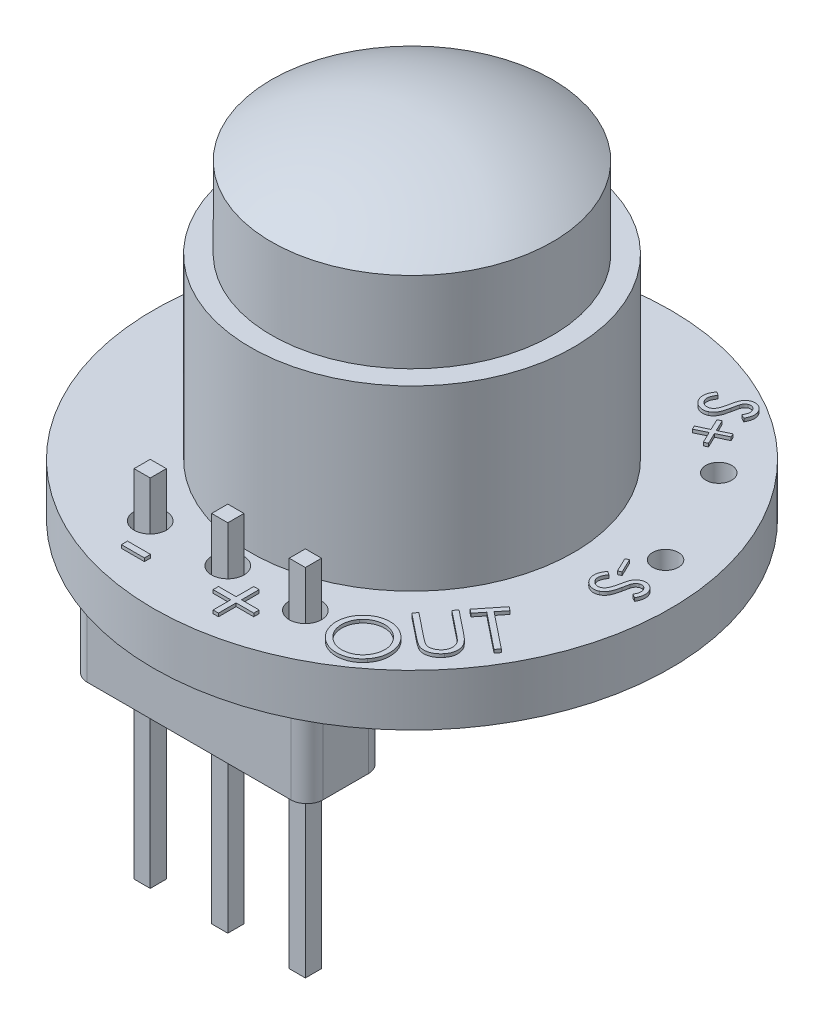
from build123d import *

# Parameters (mm, degrees)
SKETCH2_R             = 0.5
SKETCH2_R_2           = 0.4
CUT_EXTRUDE1_DEPTH    = 10
SKETCH3_W             = 0.5
SKETCH3_H             = 0.5
BOSS_EXTRUDE1_DEPTH   = 11
BOSS_EXTRUDE1_2_DEPTH = 11
BOSS_EXTRUDE1_3_DEPTH = 11
SKETCH4_W             = 7.3
SKETCH4_H             = 2.4
SKETCH4_W_2           = 0.6
SKETCH4_H_2           = 0.58
BOSS_EXTRUDE2_DEPTH   = 2.5
FILLET1_R             = 0.5
SKETCH5_W             = 0.712339744
SKETCH5_H             = 0.189957265
BOSS_EXTRUDE3_DEPTH   = 0.1
BOSS_EXTRUDE4_DEPTH   = 0.1
BOSS_EXTRUDE5_DEPTH   = 0.1
BOSS_EXTRUDE6_DEPTH   = 0.1


with BuildPart() as part:
    # Sketch1 → Revolve1 (revolve)
    with BuildSketch(Plane.XY, mode=Mode.PRIVATE) as revolve1_sk:
        with BuildLine():
            Line((0, 0), (-8, 0))
            Line((-8, 0), (-8, 1.6))
            Line((-8, 1.6), (-5, 1.6))
            Line((-5, 1.6), (-5, 7.1))
            Line((-5, 7.1), (-4.35, 7.1))
            Line((-4.35, 7.1), (-4.35, 9.6))
            ThreePointArc((-4.35, 9.6), (-2.268058239, 10.557782717), (0, 10.886022044))
            Line((0, 10.886022044), (0, 0))
        make_face()
    revolve(revolve1_sk.sketch.rotate(Axis((0, 0, 0), (0, 1, 0)), 270), axis=Axis((0, 0, 0), (0, 1, 0)))

    # Sketch2 → Cut-Extrude1 (cut)
    with BuildSketch(Plane(origin=(0, 1.6, 0), x_dir=(1, 0, 0), z_dir=(0, 1, 0))):
        with Locations(Location((0, -5.7, 0), (0, 0, 270))):
            Circle(SKETCH2_R)
        with Locations(Location((-2.4, -5.7, 0), (0, 0, 270))):
            Circle(SKETCH2_R)
        with Locations(Location((2.4, -5.7, 0), (0, 0, 270))):
            Circle(SKETCH2_R)
        with Locations(Location((5.107916726, 4.384254409, 0), (0, 0, 270))):
            Circle(SKETCH2_R_2)
        with Locations(Location((6.618665368, 1.227097691, 0), (0, 0, 270))):
            Circle(SKETCH2_R_2)
    extrude(amount=-CUT_EXTRUDE1_DEPTH, mode=Mode.SUBTRACT)

    # Sketch4 → Boss-Extrude2 (add)
    with BuildSketch(Plane.XZ):
        with Locations((0, 5.7)):
            Rectangle(SKETCH4_W, SKETCH4_H)
        with Locations((-2.4, 5.7)):
            Rectangle(SKETCH4_W_2, SKETCH4_H_2, mode=Mode.SUBTRACT)
        with Locations((2.4, 5.7)):
            Rectangle(SKETCH4_W_2, SKETCH4_H_2, mode=Mode.SUBTRACT)
        with Locations((0, 5.7)):
            Rectangle(SKETCH4_W_2, SKETCH4_H_2, mode=Mode.SUBTRACT)
    extrude(amount=BOSS_EXTRUDE2_DEPTH)

    # Fillet1
    fillet1_edges = [part.edges().sort_by_distance(p)[0] for p in [
        (-3.65, -1.25, 6.9),
        (-3.65, -1.25, 4.5),
        (3.65, -1.25, 4.5),
        (3.65, -1.25, 6.9),
    ]]
    fillet(fillet1_edges, radius=FILLET1_R)

    # Sketch5 → Boss-Extrude3 (add)
    with BuildSketch(Plane(origin=(0, 1.6, 0), x_dir=(1, 0, 0), z_dir=(0, 1, 0))):
        with Locations((-1.753838912, -6.787660257)):
            Rectangle(SKETCH5_W, SKETCH5_H)
        Polygon((1.060377968, -6.502724359), (1.060377968, -5.956597222), (1.226590575, -5.956597222), (1.226590575, -6.502724359), (1.772717712, -6.502724359), (1.772717712, -6.668936966), (1.226590575, -6.668936966), (1.226590575, -7.215064103), (1.060377968, -7.215064103), (1.060377968, -6.668936966), (0.514250831, -6.668936966), (0.514250831, -6.502724359), align=None)
    extrude(amount=BOSS_EXTRUDE3_DEPTH)

    # Sketch6 → Boss-Extrude4 (add)
    # profile 1 of 3: a face of its own
    with BuildSketch(Plane(origin=(0, 1.6, 0), x_dir=(1, 0, 0), z_dir=(0, 1, 0))):
        with BuildLine():
            add(Edge.make_bspline(
                [(3.45565374, -5.112927996), (3.474456808, -5.090635309), (3.511395438, -5.046841323), (3.572620469, -4.988039111), (3.637259679, -4.936560232), (3.705661392, -4.892738259), (3.777661719, -4.85647774), (3.853347213, -4.82826854), (3.932460888, -4.807135641), (4.01414629, -4.793619283), (4.096672819, -4.787910699), (4.178060798, -4.79000474), (4.257539746, -4.800283525), (4.335096332, -4.818329817), (4.410519648, -4.844955561), (4.483737132, -4.879768566), (4.555374312, -4.921860157), (4.60006583, -4.955786845), (4.622746088, -4.973004117)],
                knots=[0, 0, 0, 0, 1.066511499, 2.095162004, 3.100088383, 4.08562894, 5.062191344, 6.044099933, 7.035727419, 8.054037545, 9.068758869, 10.058176567, 11.028045822, 11.996129672, 12.966440888, 13.948464376, 14.958877201, 16, 16, 16, 16], degree=3))
            add(Edge.make_bspline(
                [(4.622746088, -4.973004117), (4.644444112, -4.991127776), (4.687105535, -5.026761485), (4.743636254, -5.086943249), (4.793032513, -5.150689007), (4.835802465, -5.217975564), (4.870465638, -5.2894798), (4.898393897, -5.364607135), (4.918654101, -5.443715779), (4.931387239, -5.525610757), (4.937435028, -5.6081977), (4.934690977, -5.689778549), (4.924756301, -5.769200833), (4.906320271, -5.846521852), (4.880349338, -5.921755339), (4.84573738, -5.99456073), (4.804317101, -6.065821421), (4.770585547, -6.110012363), (4.753447711, -6.132464254)],
                knots=[0, 0, 0, 0, 1.043661746, 2.051988523, 3.042879516, 4.019624495, 4.991647831, 5.972966726, 6.975971515, 8.002864854, 9.031295247, 10.030385878, 11.013508103, 11.983320138, 12.96171231, 13.948011582, 14.957455602, 16, 16, 16, 16], degree=3))
            add(Edge.make_bspline(
                [(4.753447711, -6.132464254), (4.735096632, -6.154359688), (4.698961967, -6.197473457), (4.638361795, -6.254830429), (4.574276049, -6.305005107), (4.506420815, -6.348079433), (4.434671134, -6.38328382), (4.359315129, -6.411613388), (4.280205902, -6.432161115), (4.198430146, -6.445330676), (4.116029655, -6.451173271), (4.034781262, -6.44888785), (3.955674105, -6.439240002), (3.87889817, -6.421177939), (3.804323844, -6.395720091), (3.732118175, -6.361889509), (3.66182018, -6.320731798), (3.618053467, -6.287581261), (3.595895627, -6.270798088)],
                knots=[0, 0, 0, 0, 1.055679664, 2.078713208, 3.078420863, 4.061468785, 5.044876103, 6.028463069, 7.033374715, 8.061830367, 9.087293923, 10.083267793, 11.062910567, 12.028900188, 12.994515975, 13.97130026, 14.972927109, 16, 16, 16, 16], degree=3))
            add(Edge.make_bspline(
                [(3.595895627, -6.270798088), (3.581521303, -6.258906029), (3.552932839, -6.235254433), (3.513298821, -6.196573075), (3.476318381, -6.156146443), (3.442079116, -6.113833505), (3.411303499, -6.069141274), (3.38323486, -6.022640348), (3.358030188, -5.974115142), (3.335807771, -5.923811251), (3.317264458, -5.872201853), (3.301792801, -5.820103193), (3.290087071, -5.76760585), (3.281694164, -5.714832595), (3.277311409, -5.661790928), (3.276373333, -5.608468922), (3.278818225, -5.554799797), (3.285294371, -5.501062788), (3.295059409, -5.447951143), (3.30818791, -5.395925042), (3.324294983, -5.345155483), (3.344296579, -5.295953852), (3.366553362, -5.247589964), (3.393407454, -5.201355519), (3.422335735, -5.155809866), (3.444499974, -5.127283428), (3.45565374, -5.112927996)],
                knots=[0, 0, 0, 0, 1.034884061, 2.058235615, 3.070008709, 4.074109269, 5.075984681, 6.078740394, 7.086401269, 8.108314806, 9.128008134, 10.127532292, 11.122215522, 12.110582353, 13.090511065, 14.073014041, 15.068236315, 16.069282503, 17.074192551, 18.06287441, 19.045095604, 20.027087791, 21.008604176, 21.996498276, 22.9917727, 24, 24, 24, 24], degree=3))
        make_face()
        with BuildLine():
            add(Edge.make_bspline(
                [(3.580313196, -5.20292449), (3.571563713, -5.214362402), (3.554146736, -5.237131047), (3.531007871, -5.273241676), (3.510152992, -5.310562155), (3.492173813, -5.349323864), (3.476408463, -5.38931117), (3.463377177, -5.430762617), (3.452987791, -5.473593583), (3.444962138, -5.517429803), (3.439964475, -5.561631193), (3.437680622, -5.605708767), (3.438322626, -5.649370761), (3.441794474, -5.69261363), (3.448207569, -5.735422335), (3.457397367, -5.77772001), (3.469601037, -5.819547352), (3.484432825, -5.860823609), (3.502288129, -5.900984908), (3.522320312, -5.94010247), (3.545228087, -5.977588896), (3.570872514, -6.013505196), (3.59842768, -6.048447829), (3.629229211, -6.081409671), (3.662147208, -6.113400311), (3.685962851, -6.133047621), (3.697976457, -6.142958545)],
                knots=[0, 0, 0, 0, 0.983964773, 1.958709364, 2.928486245, 3.904172917, 4.876976642, 5.864642596, 6.871601289, 7.88777202, 8.908761868, 9.909942935, 10.902698617, 11.891320892, 12.872988738, 13.859298318, 14.847601921, 15.849202396, 16.854882941, 17.849751659, 18.851325926, 19.854497622, 20.864995358, 21.890500158, 22.935880144, 24, 24, 24, 24], degree=3))
            add(Edge.make_bspline(
                [(3.697976457, -6.142958545), (3.716283938, -6.156773544), (3.752248298, -6.183912591), (3.809689679, -6.218065989), (3.868683996, -6.246099888), (3.929710506, -6.266875), (3.992020693, -6.282202936), (4.056125831, -6.290329292), (4.121840882, -6.292220318), (4.188458073, -6.287627036), (4.254343346, -6.277523839), (4.317687468, -6.260643952), (4.378191453, -6.238934768), (4.435236196, -6.210623513), (4.489377413, -6.177160821), (4.540087789, -6.13771724), (4.587894981, -6.092815384), (4.616291583, -6.058990213), (4.630696309, -6.041831742)],
                knots=[0, 0, 0, 0, 1.053355528, 2.069277367, 3.065193028, 4.049640408, 5.026792572, 6.009297442, 7.013258688, 8.04341214, 9.074175897, 10.071448894, 11.051607986, 12.023292483, 12.992543806, 13.97183087, 14.971172038, 16, 16, 16, 16], degree=3))
            add(Edge.make_bspline(
                [(4.630696309, -6.041831742), (4.639848978, -6.029851193), (4.658016816, -6.006070081), (4.682607078, -5.968765002), (4.704170443, -5.930188975), (4.723293306, -5.890689611), (4.739989534, -5.850198764), (4.75363709, -5.808515731), (4.764368605, -5.76576633), (4.772734651, -5.722354425), (4.777923139, -5.678462205), (4.781186686, -5.634826259), (4.780133407, -5.591480414), (4.777337048, -5.548616587), (4.770538744, -5.506111975), (4.762153808, -5.463838472), (4.749159752, -5.422327942), (4.734577834, -5.381055204), (4.7166449, -5.340921292), (4.696736326, -5.301839579), (4.673631851, -5.264577008), (4.648085888, -5.228712613), (4.620633891, -5.193774587), (4.589724658, -5.16122446), (4.55702962, -5.129338524), (4.533319846, -5.109795874), (4.521301276, -5.099889634)],
                knots=[0, 0, 0, 0, 1.026213425, 2.037009955, 3.03867123, 4.032791005, 5.023157936, 6.018167913, 7.015843731, 8.022173571, 9.025601079, 10.023616149, 10.997972454, 11.974891032, 12.945498563, 13.9263542, 14.90582835, 15.903425862, 16.905087137, 17.895979796, 18.887397904, 19.886560358, 20.893019572, 21.909134835, 22.94013297, 24, 24, 24, 24], degree=3))
            add(Edge.make_bspline(
                [(4.521301276, -5.099889634), (4.509132136, -5.090488853), (4.485021719, -5.071863318), (4.446952635, -5.047300207), (4.408588, -5.024683629), (4.368936561, -5.005819394), (4.328814825, -4.989044676), (4.287669545, -4.97537943), (4.24569335, -4.96457646), (4.203084555, -4.956635925), (4.160164685, -4.951552377), (4.117137211, -4.949301418), (4.074117495, -4.949986004), (4.03115512, -4.953323774), (3.988422287, -4.960305746), (3.945629842, -4.96932083), (3.90299522, -4.981917128), (3.860627238, -4.997086976), (3.819240668, -5.014673869), (3.779594495, -5.034907221), (3.741717108, -5.057101155), (3.705568288, -5.08171753), (3.671392703, -5.108644606), (3.638983984, -5.137847696), (3.608491979, -5.169198317), (3.589714985, -5.191671827), (3.580313196, -5.20292449)],
                knots=[0, 0, 0, 0, 1.050757827, 2.081840579, 3.094837263, 4.093081857, 5.08085562, 6.066234131, 7.054007893, 8.041808237, 9.026946903, 10.006552914, 10.984952035, 11.966485985, 12.949383271, 13.942908505, 14.954244963, 15.985709621, 17.018115709, 18.026019314, 19.02649715, 20.017402582, 21.013356202, 21.99852152, 22.997843949, 24, 24, 24, 24], degree=3))
        make_face(mode=Mode.SUBTRACT)
    # profile 2 of 3: a face of its own
    with BuildSketch(Plane(origin=(0, 1.6, 0), x_dir=(1, 0, 0), z_dir=(0, 1, 0))):
        with BuildLine():
            Line((4.215687219, -4.222996498), (4.313633934, -4.100245096))
            Line((4.313633934, -4.100245096), (5.05491248, -4.692059499))
            add(Edge.make_bspline(
                [(5.05491248, -4.692059499), (5.065398817, -4.700443536), (5.085259815, -4.716322802), (5.113688107, -4.738803877), (5.139393887, -4.75831531), (5.161850705, -4.775543355), (5.181370231, -4.789946542), (5.197898594, -4.801727257), (5.211510204, -4.811063477), (5.219834501, -4.816111952), (5.223457151, -4.818308998)],
                knots=[0, 0, 0, 0, 1.529341844, 2.896555115, 4.128230771, 5.205315812, 6.120604565, 6.891210804, 7.517466163, 8, 8, 8, 8], degree=3))
            add(Edge.make_bspline(
                [(5.223457151, -4.818308998), (5.236552542, -4.825825302), (5.261901739, -4.840374869), (5.301381496, -4.856530478), (5.339987574, -4.868094123), (5.378663913, -4.873663886), (5.418018232, -4.873327007), (5.458510206, -4.866637413), (5.500650037, -4.854434027), (5.543086137, -4.835907515), (5.584731334, -4.813344396), (5.622985982, -4.786417296), (5.657632079, -4.756587107), (5.677108974, -4.733668917), (5.686795993, -4.722270336)],
                knots=[0, 0, 0, 0, 1.043125178, 2.019213249, 2.942567521, 3.823755495, 4.710778409, 5.65322756, 6.653111229, 7.736937606, 8.849100576, 9.922865017, 10.966917051, 12, 12, 12, 12], degree=3))
            add(Edge.make_bspline(
                [(5.686795993, -4.722270336), (5.694573016, -4.711944075), (5.710038529, -4.691409108), (5.728742771, -4.657671671), (5.743839982, -4.622191303), (5.754801467, -4.585027195), (5.76223755, -4.547134016), (5.76512518, -4.509030212), (5.763562284, -4.471235866), (5.757367998, -4.433821775), (5.747155845, -4.396825038), (5.732714583, -4.360185778), (5.713653336, -4.324272946), (5.6979506, -4.301607061), (5.689976082, -4.290096358)],
                knots=[0, 0, 0, 0, 0.997261099, 1.983169351, 2.969892853, 3.969569931, 4.969749605, 5.94664521, 6.913439779, 7.883728152, 8.868752455, 9.8720092, 10.919315556, 12, 12, 12, 12], degree=3))
            add(Edge.make_bspline(
                [(5.689976082, -4.290096358), (5.68642804, -4.285596664), (5.678511792, -4.27555713), (5.66400848, -4.260099991), (5.646271907, -4.242419037), (5.625230849, -4.222619933), (5.60060281, -4.201158582), (5.573027585, -4.177177526), (5.541715915, -4.151478624), (5.519645116, -4.133722158), (5.50807504, -4.124413766)],
                knots=[0, 0, 0, 0, 0.557701609, 1.244321178, 2.061681397, 2.996263366, 4.056489344, 5.241981574, 6.554176416, 8, 8, 8, 8], degree=3))
            Line((5.50807504, -4.124413766), (4.766796494, -3.532599362))
            Line((4.766796494, -3.532599362), (4.865061218, -3.40984796))
            Line((4.865061218, -3.40984796), (5.606339764, -4.001662363))
            add(Edge.make_bspline(
                [(5.606339764, -4.001662363), (5.619672422, -4.012376485), (5.645715734, -4.033304885), (5.682486634, -4.065609116), (5.716899786, -4.096819396), (5.748124312, -4.127867513), (5.776751361, -4.158092838), (5.80305789, -4.18745384), (5.825840606, -4.216927906), (5.846559467, -4.245666655), (5.864642288, -4.274873725), (5.880051365, -4.30526745), (5.892628252, -4.337177562), (5.903271268, -4.370276906), (5.911078411, -4.404781029), (5.916936275, -4.440555336), (5.920004143, -4.477764729), (5.920688808, -4.516015793), (5.918523484, -4.554620982), (5.913211497, -4.592971438), (5.904108094, -4.630570846), (5.892185395, -4.6677564), (5.875953195, -4.70389107), (5.85714435, -4.739803001), (5.835025507, -4.775170698), (5.817697904, -4.797464125), (5.808911378, -4.808768733)],
                knots=[0, 0, 0, 0, 1.299983518, 2.539319159, 3.719842426, 4.830894536, 5.88534066, 6.884393406, 7.825727116, 8.71557918, 9.576543404, 10.434183136, 11.30202001, 12.181191921, 13.074430304, 13.988469102, 14.934652864, 15.909763273, 16.894414977, 17.870989117, 18.848194645, 19.831757771, 20.834799286, 21.854817962, 22.912215483, 24, 24, 24, 24], degree=3))
            add(Edge.make_bspline(
                [(5.808911378, -4.808768733), (5.799015813, -4.820796798), (5.779542685, -4.844466396), (5.747769883, -4.876767416), (5.715538476, -4.906627364), (5.681527243, -4.932759735), (5.646518065, -4.955932211), (5.610612901, -4.976611765), (5.573164728, -4.993249991), (5.535135439, -5.007471428), (5.496422655, -5.017760493), (5.457850162, -5.025161745), (5.419673605, -5.029403816), (5.381667487, -5.030054704), (5.343998592, -5.027150924), (5.306579229, -5.021013217), (5.269441156, -5.011977297), (5.245429898, -5.003099259), (5.233315425, -4.998619995)],
                knots=[0, 0, 0, 0, 1.148121159, 2.259346517, 3.338428395, 4.386101709, 5.418171225, 6.433404605, 7.437530958, 8.436715205, 9.424735718, 10.387600952, 11.331200203, 12.253807945, 13.186757595, 14.113397242, 15.048146597, 16, 16, 16, 16], degree=3))
            add(Edge.make_bspline(
                [(5.233315425, -4.998619995), (5.225317413, -4.995224309), (5.207976908, -4.987862115), (5.181093057, -4.97365704), (5.151045852, -4.956077106), (5.118261519, -4.934656176), (5.081970473, -4.910182301), (5.043233326, -4.881334922), (5.000712785, -4.849748828), (4.971947199, -4.826775607), (4.956965765, -4.814810901)],
                knots=[0, 0, 0, 0, 0.626278209, 1.357835047, 2.19024504, 3.135814201, 4.180953577, 5.345862278, 6.617695802, 8, 8, 8, 8], degree=3))
            Line((4.956965765, -4.814810901), (4.215687219, -4.222996498))
        make_face()
    # profile 3 of 3: a face of its own
    with BuildSketch(Plane(origin=(0, 1.6, 0), x_dir=(1, 0, 0), z_dir=(0, 1, 0))):
        Polygon((5.135109249, -3.314252852), (5.015855944, -3.219168217), (5.553926857, -2.545625549), (5.673180162, -2.640710184), (5.454390098, -2.914515773), (6.562968824, -3.799852312), (6.463114057, -3.925147784), (5.354535331, -3.039811246), align=None)
    extrude(amount=BOSS_EXTRUDE4_DEPTH)

    # Sketch7 → Boss-Extrude5 (add)
    # profile 1 of 5: a face of its own
    with BuildSketch(Plane(origin=(0, 1.6, 0), x_dir=(1, 0, 0), z_dir=(0, 1, 0))):
        with BuildLine():
            Line((-2.684158384, 7.248012811), (-2.708327054, 7.093460528))
            add(Edge.make_bspline(
                [(-2.708327054, 7.093460528), (-2.731695746, 7.097700972), (-2.7764203, 7.105816614), (-2.841578449, 7.110776205), (-2.901309211, 7.110462423), (-2.955784726, 7.102707769), (-3.005054946, 7.089333091), (-3.049169293, 7.069488568), (-3.087831506, 7.042935964), (-3.108760296, 7.020415749), (-3.119194442, 7.009188192)],
                knots=[0, 0, 0, 0, 1.293405282, 2.475404832, 3.555726147, 4.541728328, 5.465316488, 6.328686665, 7.166759007, 8, 8, 8, 8], degree=3))
            add(Edge.make_bspline(
                [(-3.119194442, 7.009188192), (-3.127202789, 6.998880041), (-3.143141295, 6.978364381), (-3.16216512, 6.944396036), (-3.176936643, 6.908388924), (-3.187286109, 6.870921625), (-3.193236636, 6.833016336), (-3.193433242, 6.79577337), (-3.189086054, 6.759679645), (-3.179506296, 6.725123992), (-3.165413709, 6.692584278), (-3.147611196, 6.662630443), (-3.126177996, 6.635447846), (-3.109245855, 6.620042851), (-3.10074993, 6.612313192)],
                knots=[0, 0, 0, 0, 1.062818521, 2.115260257, 3.161440792, 4.228465735, 5.276927396, 6.279264429, 7.254533303, 8.231370227, 9.191206659, 10.136622781, 11.065025959, 12, 12, 12, 12], degree=3))
            add(Edge.make_bspline(
                [(-3.10074993, 6.612313192), (-3.090174095, 6.604411193), (-3.068750317, 6.588403884), (-3.031536287, 6.570999406), (-2.990382403, 6.559164734), (-2.961430293, 6.555623719), (-2.946515656, 6.55379957)],
                knots=[0, 0, 0, 0, 0.944074053, 1.912438393, 2.924595624, 4, 4, 4, 4], degree=3))
            add(Edge.make_bspline(
                [(-2.946515656, 6.55379957), (-2.935177366, 6.553142705), (-2.911454196, 6.551768341), (-2.873966821, 6.552228102), (-2.833133527, 6.554919655), (-2.788677716, 6.559384036), (-2.740839247, 6.566084213), (-2.689563688, 6.575170433), (-2.634844842, 6.585943083), (-2.59732416, 6.594314624), (-2.57794344, 6.598638813)],
                knots=[0, 0, 0, 0, 0.731427744, 1.530370624, 2.412916412, 3.366855266, 4.407855327, 5.523716838, 6.720914716, 8, 8, 8, 8], degree=3))
            add(Edge.make_bspline(
                [(-2.57794344, 6.598638813), (-2.558662931, 6.603039291), (-2.521849649, 6.611441353), (-2.468957489, 6.622619076), (-2.421040281, 6.63188226), (-2.378102193, 6.639186262), (-2.340177663, 6.64492097), (-2.307150258, 6.647837309), (-2.279137201, 6.650026917), (-2.262162115, 6.649238675), (-2.254528476, 6.648884206)],
                knots=[0, 0, 0, 0, 1.44652743, 2.761930328, 3.954127154, 5.015951821, 5.948003039, 6.758101147, 7.441522298, 8, 8, 8, 8], degree=3))
            add(Edge.make_bspline(
                [(-2.254528476, 6.648884206), (-2.243058704, 6.648127429), (-2.220436038, 6.646634783), (-2.187300224, 6.641014413), (-2.155260654, 6.633448516), (-2.124460043, 6.623356558), (-2.095064639, 6.610499281), (-2.066977614, 6.595379718), (-2.039755686, 6.578476586), (-2.023099142, 6.56500467), (-2.01474983, 6.558251694)],
                knots=[0, 0, 0, 0, 1.05636292, 2.083541417, 3.08595596, 4.081570525, 5.059419876, 6.031861724, 7.013444726, 8, 8, 8, 8], degree=3))
            add(Edge.make_bspline(
                [(-2.01474983, 6.558251694), (-2.002243435, 6.547010168), (-1.977508202, 6.524776603), (-1.946275371, 6.486297871), (-1.920880259, 6.444541861), (-1.901497476, 6.399903284), (-1.888089261, 6.353306462), (-1.881294062, 6.305245339), (-1.881389917, 6.256233107), (-1.888147703, 6.206758398), (-1.901134808, 6.158058435), (-1.920011598, 6.111216978), (-1.944936667, 6.066746089), (-1.96594041, 6.039855694), (-1.976588772, 6.026222948)],
                knots=[0, 0, 0, 0, 1.016602265, 2.010642858, 2.986650846, 3.966447372, 4.94733564, 5.912763226, 6.894406604, 7.904325903, 8.926802839, 9.937129659, 10.954177243, 12, 12, 12, 12], degree=3))
            add(Edge.make_bspline(
                [(-1.976588772, 6.026222948), (-1.988823891, 6.012476619), (-2.013109639, 5.985191236), (-2.05610551, 5.951300238), (-2.102629824, 5.922558352), (-2.144848186, 5.903686624), (-2.181284178, 5.891757941), (-2.211319576, 5.884645486), (-2.243644939, 5.878461769), (-2.278513639, 5.874514929), (-2.315758947, 5.871948313), (-2.355543795, 5.87120786), (-2.39776997, 5.871270579), (-2.426682108, 5.873006157), (-2.441517659, 5.873896726)],
                knots=[0, 0, 0, 0, 1.296186183, 2.572827748, 3.845256252, 5.147577217, 5.823996161, 6.547753535, 7.323725672, 8.144705779, 9.021783, 9.956917682, 10.951642668, 12, 12, 12, 12], degree=3))
            Line((-2.441517659, 5.873896726), (-2.433885447, 6.035445203))
            add(Edge.make_bspline(
                [(-2.433885447, 6.035445203), (-2.421908454, 6.034997627), (-2.398913251, 6.034138303), (-2.365619738, 6.033271993), (-2.334754691, 6.034007917), (-2.306317099, 6.035476172), (-2.280328749, 6.0380672), (-2.256797467, 6.041324033), (-2.235832385, 6.046227129), (-2.211105109, 6.053258007), (-2.183096412, 6.065478544), (-2.152365638, 6.084176976), (-2.123869169, 6.106378831), (-2.107779083, 6.124331132), (-2.099658184, 6.133391918)],
                knots=[0, 0, 0, 0, 1.188125187, 2.281138537, 3.300611859, 4.247772235, 5.103045265, 5.889166431, 6.600366815, 7.235458859, 8.435834274, 9.614395521, 10.795950895, 12, 12, 12, 12], degree=3))
            add(Edge.make_bspline(
                [(-2.099658184, 6.133391918), (-2.090391082, 6.145489027), (-2.072483308, 6.168865515), (-2.053914769, 6.208181662), (-2.044175064, 6.248920727), (-2.043118554, 6.290081647), (-2.049160436, 6.330153839), (-2.063468758, 6.367364844), (-2.085148402, 6.401224846), (-2.104828111, 6.419465671), (-2.114922607, 6.428822106)],
                knots=[0, 0, 0, 0, 1.104768761, 2.134858295, 3.13236084, 4.126319214, 5.108844294, 6.057118042, 7.003419512, 8, 8, 8, 8], degree=3))
            add(Edge.make_bspline(
                [(-2.114922607, 6.428822106), (-2.121598424, 6.434062442), (-2.134971927, 6.444560281), (-2.156987549, 6.45755754), (-2.180545297, 6.468026844), (-2.205639892, 6.476907496), (-2.233490043, 6.483006225), (-2.264628679, 6.485873408), (-2.299417745, 6.486687284), (-2.323757638, 6.48461229), (-2.33657475, 6.483519622)],
                knots=[0, 0, 0, 0, 0.866286222, 1.735410298, 2.60291388, 3.496714424, 4.450428772, 5.506367805, 6.686881455, 8, 8, 8, 8], degree=3))
            add(Edge.make_bspline(
                [(-2.33657475, 6.483519622), (-2.341030318, 6.482906505), (-2.351666844, 6.481442846), (-2.370232389, 6.478186673), (-2.393936819, 6.473308066), (-2.422918171, 6.467353438), (-2.457030585, 6.459613849), (-2.496327411, 6.450367593), (-2.540947881, 6.43984404), (-2.572431155, 6.432425607), (-2.589073748, 6.428504097)],
                knots=[0, 0, 0, 0, 0.41754574, 0.996783341, 1.749524629, 2.664427385, 3.743648285, 4.996942581, 6.412532805, 8, 8, 8, 8], degree=3))
            add(Edge.make_bspline(
                [(-2.589073748, 6.428504097), (-2.609079777, 6.423713996), (-2.647909344, 6.414416919), (-2.704765971, 6.402983084), (-2.758240159, 6.394117251), (-2.808267348, 6.38720009), (-2.855076593, 6.38313209), (-2.898580045, 6.381029243), (-2.938737375, 6.381562097), (-2.975722004, 6.384702066), (-3.010168504, 6.390359833), (-3.042918927, 6.39721753), (-3.074270542, 6.405975586), (-3.103768026, 6.417467371), (-3.132336156, 6.429535679), (-3.159025386, 6.444347877), (-3.184243304, 6.460810837), (-3.19984741, 6.473219701), (-3.207600892, 6.479385508)],
                knots=[0, 0, 0, 0, 1.531459641, 2.972399831, 4.316530809, 5.566597053, 6.731237031, 7.813466526, 8.807973759, 9.718969414, 10.573996258, 11.405199452, 12.209556122, 12.993760493, 13.760618039, 14.51643167, 15.262833799, 16, 16, 16, 16], degree=3))
            add(Edge.make_bspline(
                [(-3.207600892, 6.479385508), (-3.218202966, 6.48870569), (-3.239134425, 6.507106335), (-3.266619688, 6.538383075), (-3.290470559, 6.571737399), (-3.310739107, 6.607287761), (-3.326913097, 6.645113274), (-3.339777668, 6.685004136), (-3.348504556, 6.727237614), (-3.35397265, 6.771049523), (-3.355211901, 6.815455163), (-3.352377686, 6.859216007), (-3.345463046, 6.901892184), (-3.333776566, 6.943217377), (-3.318653161, 6.98365995), (-3.298586834, 7.02240305), (-3.275102454, 7.060441136), (-3.256299979, 7.083997461), (-3.246715976, 7.096004598)],
                knots=[0, 0, 0, 0, 0.98653909, 1.947703887, 2.904425789, 3.850748232, 4.80387207, 5.776973729, 6.777456744, 7.815743692, 8.861600909, 9.879569258, 10.87909023, 11.879243505, 12.87895696, 13.89362574, 14.926338309, 16, 16, 16, 16], degree=3))
            add(Edge.make_bspline(
                [(-3.246715976, 7.096004598), (-3.238895402, 7.105029235), (-3.22351165, 7.122781483), (-3.198344751, 7.147152637), (-3.17202948, 7.169408143), (-3.144286667, 7.189505286), (-3.115263161, 7.207354919), (-3.084898567, 7.223073645), (-3.053148273, 7.236290445), (-3.020045706, 7.247613049), (-2.985298747, 7.256530181), (-2.948506086, 7.262902599), (-2.909597635, 7.266512762), (-2.868502525, 7.268301394), (-2.825299357, 7.266680356), (-2.77994872, 7.263372723), (-2.732658045, 7.256818539), (-2.700568225, 7.250992226), (-2.684158384, 7.248012811)],
                knots=[0, 0, 0, 0, 0.93085302, 1.831068974, 2.728586307, 3.616497699, 4.499741019, 5.3833324, 6.279897581, 7.179126247, 8.109391839, 9.074270311, 10.087609769, 11.154746453, 12.279431786, 13.456744589, 14.699449998, 16, 16, 16, 16], degree=3))
        make_face()
    # profile 2 of 5: a face of its own
    with BuildSketch(Plane(origin=(0, 1.6, 0), x_dir=(1, 0, 0), z_dir=(0, 1, 0))):
        with BuildLine():
            Line((-2.511427124, 5.447126922), (-2.713680729, 5.205440223))
            add(Edge.make_bspline(
                [(-2.713680729, 5.205440223), (-2.727187699, 5.189275318), (-2.753029158, 5.15834871), (-2.791105756, 5.114765342), (-2.825831543, 5.075309737), (-2.858012489, 5.040579537), (-2.887249144, 5.01044064), (-2.913292397, 4.98440878), (-2.936676305, 4.963113836), (-2.95171557, 4.950870735), (-2.958547516, 4.945309013)],
                knots=[0, 0, 0, 0, 1.413129804, 2.703592196, 3.882354506, 4.939095828, 5.87953774, 6.699191181, 7.409076409, 8, 8, 8, 8], degree=3))
            add(Edge.make_bspline(
                [(-2.958547516, 4.945309013), (-2.968205079, 4.938384595), (-2.987291434, 4.924699785), (-3.017233935, 4.906846929), (-3.047927425, 4.891902099), (-3.079201598, 4.879301517), (-3.111367878, 4.869778152), (-3.144270295, 4.863171913), (-3.177747874, 4.858924891), (-3.211689752, 4.857722687), (-3.245748098, 4.859227016), (-3.279422226, 4.863937499), (-3.312447958, 4.872119573), (-3.344980157, 4.882838335), (-3.376904822, 4.896936674), (-3.408191293, 4.914322411), (-3.439024533, 4.934502574), (-3.458474608, 4.950124987), (-3.468315645, 4.958029365)],
                knots=[0, 0, 0, 0, 1.029795294, 2.035196582, 3.01736098, 3.986544661, 4.954682366, 5.920593611, 6.892778204, 7.876660425, 8.860928743, 9.844639316, 10.818559335, 11.806509414, 12.810397934, 13.838552119, 14.906385216, 16, 16, 16, 16], degree=3))
            add(Edge.make_bspline(
                [(-3.468315645, 4.958029365), (-3.483881317, 4.971937002), (-3.514355413, 4.999165036), (-3.55234739, 5.046095507), (-3.582713571, 5.0961078), (-3.604800367, 5.149286251), (-3.618638966, 5.204704616), (-3.623332349, 5.261800115), (-3.619468552, 5.320015543), (-3.608591255, 5.368868706), (-3.595784302, 5.408825202), (-3.582349383, 5.439925808), (-3.56699397, 5.472533125), (-3.547856756, 5.505767422), (-3.526737729, 5.540612734), (-3.502070599, 5.576096087), (-3.474668451, 5.612767366), (-3.454937526, 5.637149999), (-3.444782993, 5.649698536)],
                knots=[0, 0, 0, 0, 1.271861019, 2.490018831, 3.66793922, 4.830580208, 5.989762342, 7.13859645, 8.311766746, 9.535884537, 10.182172239, 10.86921045, 11.601056785, 12.379996679, 13.207470857, 14.086490997, 15.015211369, 16, 16, 16, 16], degree=3))
            Line((-3.444782993, 5.649698536), (-4.373686739, 5.684997515))
            Line((-4.373686739, 5.684997515), (-4.248073257, 5.835097675))
            Line((-4.248073257, 5.835097675), (-3.319805529, 5.799162679))
            Line((-3.319805529, 5.799162679), (-3.261927925, 5.8684886))
            Line((-3.261927925, 5.8684886), (-3.826075561, 6.340095672))
            Line((-3.826075561, 6.340095672), (-3.724630749, 6.46125703))
            Line((-3.724630749, 6.46125703), (-2.511427124, 5.447126922))
        make_face()
        with BuildLine():
            Line((-2.731489223, 5.425184313), (-3.143946655, 5.769905868))
            Line((-3.143946655, 5.769905868), (-3.320123538, 5.562246112))
            add(Edge.make_bspline(
                [(-3.320123538, 5.562246112), (-3.328235723, 5.552432501), (-3.343954215, 5.533417258), (-3.365773, 5.505192154), (-3.385498893, 5.478465136), (-3.402101886, 5.452584037), (-3.417186429, 5.428616747), (-3.42985477, 5.405901877), (-3.43957534, 5.384316317), (-3.449844987, 5.357941016), (-3.45772186, 5.325595305), (-3.461399845, 5.286897292), (-3.458821427, 5.248451546), (-3.450145373, 5.210822487), (-3.43590235, 5.174856471), (-3.416050631, 5.141662369), (-3.392370021, 5.110469652), (-3.372704289, 5.093088498), (-3.362736719, 5.084278865)],
                knots=[0, 0, 0, 0, 1.116236397, 2.162863901, 3.127685928, 4.027324493, 4.85781702, 5.610680761, 6.305240904, 6.931804578, 8.090415848, 9.210360426, 10.328104755, 11.453128123, 12.583551359, 13.704112773, 14.836330242, 16, 16, 16, 16], degree=3))
            add(Edge.make_bspline(
                [(-3.362736719, 5.084278865), (-3.352459166, 5.076322911), (-3.33211647, 5.060575432), (-3.298022476, 5.042787558), (-3.262035805, 5.030171356), (-3.224492232, 5.023326082), (-3.186674453, 5.021563774), (-3.14957663, 5.025808875), (-3.113953721, 5.035385921), (-3.085406873, 5.048119112), (-3.062490579, 5.061571302), (-3.044408112, 5.075071109), (-3.024648411, 5.090823791), (-3.003958386, 5.109415673), (-2.982113698, 5.131069612), (-2.959234909, 5.155371134), (-2.934746194, 5.182229013), (-2.918619479, 5.201456293), (-2.910210176, 5.21148239)],
                knots=[0, 0, 0, 0, 1.1609165, 2.297839924, 3.422554902, 4.560901358, 5.699919185, 6.797477887, 7.887925391, 8.987571682, 9.5828509, 10.261971053, 11.003997309, 11.84354918, 12.748871641, 13.755115475, 14.829401153, 16, 16, 16, 16], degree=3))
            Line((-2.910210176, 5.21148239), (-2.731489223, 5.425184313))
        make_face(mode=Mode.SUBTRACT)
    # profile 3 of 5: a face of its own
    with BuildSketch(Plane(origin=(0, 1.6, 0), x_dir=(1, 0, 0), z_dir=(0, 1, 0))):
        with BuildLine():
            Line((-3.73067945, 3.92527566), (-3.879507575, 3.8798004))
            Line((-3.879507575, 3.8798004), (-4.102113745, 4.62235098))
            add(Edge.make_bspline(
                [(-4.102113745, 4.62235098), (-4.107716419, 4.608676298), (-4.118625408, 4.582050266), (-4.138376705, 4.544853742), (-4.158966808, 4.51035524), (-4.175238904, 4.48989883), (-4.183205993, 4.479883032)],
                knots=[0, 0, 0, 0, 1.076665876, 2.096380751, 3.067956394, 4, 4, 4, 4], degree=3))
            add(Edge.make_bspline(
                [(-4.183205993, 4.479883032), (-4.19335781, 4.468309994), (-4.213369865, 4.445496318), (-4.247188417, 4.415606156), (-4.282668421, 4.389308313), (-4.320674297, 4.367633923), (-4.360481231, 4.349533618), (-4.402754598, 4.336423623), (-4.446884361, 4.326682091), (-4.492589713, 4.321545052), (-4.5387977, 4.319991173), (-4.584369926, 4.323694622), (-4.628915729, 4.331252234), (-4.672315954, 4.343351661), (-4.714470462, 4.360164124), (-4.755766393, 4.38076585), (-4.795623424, 4.406436198), (-4.82075845, 4.426246629), (-4.833534017, 4.436315824)],
                knots=[0, 0, 0, 0, 1.016609958, 2.004020865, 2.976579252, 3.930793524, 4.890471119, 5.861008393, 6.850480366, 7.873372514, 8.896696496, 9.901577207, 10.889882598, 11.879255341, 12.873281186, 13.885366133, 14.925179325, 16, 16, 16, 16], degree=3))
            add(Edge.make_bspline(
                [(-4.833534017, 4.436315824), (-4.850188915, 4.451148953), (-4.88283958, 4.480228179), (-4.923798844, 4.530728476), (-4.95751589, 4.584709997), (-4.983436975, 4.642464674), (-5.000826005, 4.703082296), (-5.010377848, 4.76553417), (-5.010296322, 4.829510562), (-5.002570209, 4.89411157), (-4.98588909, 4.95758714), (-4.962119778, 5.018572255), (-4.930007417, 5.075824198), (-4.903304215, 5.110484673), (-4.889821578, 5.127984995)],
                knots=[0, 0, 0, 0, 1.036330215, 2.031646901, 3.01300658, 3.99108843, 4.966717147, 5.939111266, 6.920669249, 7.934404377, 8.958454525, 9.965978925, 10.973008195, 12, 12, 12, 12], degree=3))
            add(Edge.make_bspline(
                [(-4.889821578, 5.127984995), (-4.875601636, 5.143877816), (-4.847397297, 5.175400203), (-4.798180918, 5.215053579), (-4.744915167, 5.248368323), (-4.68737397, 5.273896858), (-4.627157679, 5.292168559), (-4.56507738, 5.3017893), (-4.502022096, 5.30281301), (-4.438768114, 5.294589117), (-4.376888405, 5.278738485), (-4.317420158, 5.255961225), (-4.26185194, 5.224749671), (-4.228175412, 5.198899863), (-4.211190768, 5.185862599)],
                knots=[0, 0, 0, 0, 1.01108554, 2.005423111, 2.988630093, 3.986629124, 4.98497073, 5.967971594, 6.959554196, 7.968959879, 8.986985962, 9.986088421, 10.984290474, 12, 12, 12, 12], degree=3))
            add(Edge.make_bspline(
                [(-4.211190768, 5.185862599), (-4.198862041, 5.174981337), (-4.17385639, 5.152911496), (-4.140170836, 5.114394566), (-4.108386513, 5.071761674), (-4.078224019, 5.023844695), (-4.050069933, 4.968757644), (-4.022720264, 4.905152956), (-3.996605142, 4.831958941), (-3.980721403, 4.779626687), (-3.972366149, 4.752098577)],
                knots=[0, 0, 0, 0, 0.784521981, 1.591201043, 2.437545377, 3.322327837, 4.291299357, 5.38864803, 6.626361792, 8, 8, 8, 8], degree=3))
            Line((-3.972366149, 4.752098577), (-3.73067945, 3.92527566))
        make_face()
        with BuildLine():
            add(Edge.make_bspline(
                [(-4.265570275, 4.597864302), (-4.258485324, 4.606734505), (-4.244620549, 4.624092899), (-4.227356409, 4.652255697), (-4.212946638, 4.68115234), (-4.201763064, 4.711215291), (-4.19376999, 4.742228518), (-4.189006963, 4.774199225), (-4.187423293, 4.807118705), (-4.189148577, 4.840518862), (-4.193355213, 4.873791066), (-4.201186186, 4.905858066), (-4.211186382, 4.936678509), (-4.224731095, 4.9658658), (-4.241352666, 4.99342425), (-4.260494056, 5.019802009), (-4.282839395, 5.044381858), (-4.29966034, 5.059134287), (-4.308183457, 5.066609294)],
                knots=[0, 0, 0, 0, 1.039622142, 2.034470746, 3.020790762, 3.995316586, 4.968533898, 5.950970277, 6.952862731, 7.983868882, 9.013042296, 10.021648694, 11.004805423, 11.978556044, 12.963295687, 13.950476658, 14.961513436, 16, 16, 16, 16], degree=3))
            add(Edge.make_bspline(
                [(-4.308183457, 5.066609294), (-4.317090292, 5.073532054), (-4.334613233, 5.087151606), (-4.362378215, 5.104961727), (-4.391575494, 5.118815735), (-4.421518418, 5.130129417), (-4.452551863, 5.138082678), (-4.484517777, 5.142859058), (-4.517435913, 5.144429234), (-4.550846697, 5.142745459), (-4.583951484, 5.138403698), (-4.616079228, 5.13115995), (-4.646530237, 5.12049285), (-4.675799287, 5.107573432), (-4.703198835, 5.091160589), (-4.729198219, 5.071899743), (-4.753660307, 5.049688881), (-4.768487285, 5.033039515), (-4.775974422, 5.02463213)],
                knots=[0, 0, 0, 0, 1.036721582, 2.039603334, 3.024479077, 4.001807027, 4.977822702, 5.963083953, 6.967857222, 8.001827902, 9.033960574, 10.033760977, 11.022869041, 11.995376661, 12.969591164, 13.951764117, 14.965708004, 16, 16, 16, 16], degree=3))
            add(Edge.make_bspline(
                [(-4.775974422, 5.02463213), (-4.782897234, 5.015725298), (-4.796516888, 4.998202362), (-4.81432627, 4.97043734), (-4.828183009, 4.941240208), (-4.8394866, 4.911296743), (-4.847477541, 4.880265317), (-4.852111908, 4.848286153), (-4.854231403, 4.815391727), (-4.852400335, 4.781967171), (-4.848066415, 4.748761941), (-4.840846525, 4.716535196), (-4.830369006, 4.685930894), (-4.816625041, 4.657076457), (-4.801026034, 4.629245824), (-4.781638447, 4.603337046), (-4.759272353, 4.579145315), (-4.742708784, 4.564342452), (-4.734315267, 4.556841165)],
                knots=[0, 0, 0, 0, 1.036622074, 2.039407565, 3.024188777, 4.001422919, 4.977344914, 5.962511596, 6.967707917, 8.001579353, 9.033612957, 10.042814529, 11.031827655, 11.999447104, 12.977069693, 13.959148374, 14.965807279, 16, 16, 16, 16], degree=3))
            add(Edge.make_bspline(
                [(-4.734315267, 4.556841165), (-4.725447716, 4.549751197), (-4.707909974, 4.535729058), (-4.679481588, 4.518449274), (-4.650403325, 4.503860101), (-4.620272156, 4.492829241), (-4.589272786, 4.484228676), (-4.557108541, 4.479811482), (-4.524121896, 4.47760601), (-4.490704264, 4.479501901), (-4.457434628, 4.483661733), (-4.425369177, 4.491508566), (-4.394540308, 4.50149152), (-4.365516873, 4.515027718), (-4.338026578, 4.531315343), (-4.312043559, 4.550502943), (-4.287880316, 4.572917167), (-4.273073543, 4.589474132), (-4.265570275, 4.597864302)],
                knots=[0, 0, 0, 0, 1.039702551, 2.056265058, 3.04266136, 4.017262557, 4.993025493, 5.985147827, 6.987635865, 8.018721759, 9.047974773, 10.05665918, 11.03989195, 12.013717885, 12.985214322, 13.964647005, 14.968593687, 16, 16, 16, 16], degree=3))
        make_face(mode=Mode.SUBTRACT)
    # profile 4 of 5: a face of its own
    with BuildSketch(Plane(origin=(0, 1.6, 0), x_dir=(1, 0, 0), z_dir=(0, 1, 0))):
        with BuildLine():
            add(Edge.make_bspline(
                [(-4.678004737, 4.086574602), (-4.658732772, 4.07013697), (-4.621248094, 4.038165174), (-4.568121287, 3.990016588), (-4.520040346, 3.942740699), (-4.476332554, 3.897207607), (-4.437692068, 3.852442821), (-4.403656066, 3.809158636), (-4.374443153, 3.76689166), (-4.349767568, 3.725784775), (-4.329368566, 3.685215798), (-4.311696667, 3.645507456), (-4.297346218, 3.605981209), (-4.286104601, 3.566782151), (-4.278210076, 3.527845797), (-4.272973743, 3.489289956), (-4.27105166, 3.450992892), (-4.272367733, 3.413136635), (-4.276536094, 3.376057785), (-4.283126998, 3.339864791), (-4.292754432, 3.30492131), (-4.304820676, 3.270936129), (-4.319914482, 3.238167562), (-4.337427592, 3.206207768), (-4.357711961, 3.175331631), (-4.373196026, 3.155964299), (-4.380984504, 3.146222539)],
                knots=[0, 0, 0, 0, 1.643993172, 3.197626918, 4.652320135, 6.019795141, 7.292907061, 8.48889341, 9.591961112, 10.625576922, 11.597885558, 12.537463435, 13.445034137, 14.324877497, 15.181688949, 16.021424951, 16.848065683, 17.667257366, 18.477180199, 19.267940345, 20.052389936, 20.827124605, 21.606063693, 22.3912672, 23.190808052, 24, 24, 24, 24], degree=3))
            add(Edge.make_bspline(
                [(-4.380984504, 3.146222539), (-4.389310784, 3.136643179), (-4.405806338, 3.117665093), (-4.433003714, 3.092010821), (-4.461503205, 3.06851584), (-4.4915575, 3.047592501), (-4.523420614, 3.029289553), (-4.55678203, 3.013566001), (-4.591482616, 2.999607001), (-4.62785547, 2.989021353), (-4.665303186, 2.980543862), (-4.704055804, 2.975615469), (-4.743806808, 2.973270669), (-4.784721967, 2.974433816), (-4.826713952, 2.978130439), (-4.869787461, 2.985374875), (-4.914010731, 2.995132895), (-4.959344056, 3.008342654), (-5.006060278, 3.024745554), (-5.053703254, 3.046158882), (-5.103216792, 3.070892659), (-5.153957192, 3.100278324), (-5.206177763, 3.133831337), (-5.259876021, 3.171355837), (-5.314981379, 3.213117233), (-5.351540476, 3.243091074), (-5.370309925, 3.25847965)],
                knots=[0, 0, 0, 0, 0.817339333, 1.619266385, 2.405449416, 3.195509303, 3.975736317, 4.770035953, 5.570332597, 6.382834967, 7.20809755, 8.041711811, 8.896789644, 9.771259707, 10.676527122, 11.610729599, 12.58341213, 13.592878258, 14.651405961, 15.770679898, 16.955804169, 18.216364247, 19.546376426, 20.954152364, 22.436261117, 24, 24, 24, 24], degree=3))
            add(Edge.make_bspline(
                [(-5.370309925, 3.25847965), (-5.38876965, 3.27413613), (-5.424736769, 3.304641376), (-5.475211347, 3.351452718), (-5.52151856, 3.397319493), (-5.563600568, 3.442366417), (-5.601213832, 3.486996396), (-5.63463937, 3.530762211), (-5.663825967, 3.573757485), (-5.688424098, 3.616247572), (-5.709083686, 3.658258149), (-5.727152262, 3.699491909), (-5.741392859, 3.740588342), (-5.752591286, 3.781182734), (-5.760920128, 3.821207294), (-5.766222634, 3.860851343), (-5.767584319, 3.900109551), (-5.766545963, 3.938827456), (-5.761859892, 3.976736276), (-5.755023599, 4.013781032), (-5.745055813, 4.049670807), (-5.732741687, 4.084529383), (-5.717337564, 4.117948284), (-5.69943927, 4.150302737), (-5.678747775, 4.181529499), (-5.663128305, 4.20127124), (-5.655245823, 4.211234057)],
                knots=[0, 0, 0, 0, 1.56105138, 3.04156856, 4.438769213, 5.764324799, 7.016171793, 8.201757153, 9.314885985, 10.365625086, 11.365482604, 12.333267515, 13.267379546, 14.168064964, 15.047692009, 15.902523688, 16.744184248, 17.578761358, 18.397990109, 19.205233916, 20.006374262, 20.797887425, 21.587241979, 22.376833381, 23.180856846, 24, 24, 24, 24], degree=3))
            add(Edge.make_bspline(
                [(-5.655245823, 4.211234057), (-5.647026569, 4.220707866), (-5.630843273, 4.239361315), (-5.604074834, 4.264604125), (-5.576024347, 4.287554393), (-5.546553831, 4.308404676), (-5.515138469, 4.326044984), (-5.482645408, 4.341853252), (-5.448562187, 4.354819629), (-5.413158512, 4.365295594), (-5.376538921, 4.373430869), (-5.338734168, 4.378017936), (-5.299944479, 4.37993887), (-5.260284378, 4.379029858), (-5.219577036, 4.374790624), (-5.177966478, 4.367373438), (-5.135302297, 4.357113557), (-5.091333381, 4.344082722), (-5.046076122, 4.327084197), (-4.998976614, 4.305935949), (-4.950226494, 4.279987951), (-4.899232788, 4.250066177), (-4.846440968, 4.215608038), (-4.791876809, 4.176664367), (-4.735005455, 4.133795528), (-4.697385719, 4.102630329), (-4.678004737, 4.086574602)],
                knots=[0, 0, 0, 0, 0.814714867, 1.604132403, 2.387453959, 3.169137844, 3.94674298, 4.726329278, 5.515746814, 6.313537194, 7.124310223, 7.950622935, 8.785251134, 9.646660243, 10.526171825, 11.442473167, 12.391596195, 13.376788617, 14.420987592, 15.531104122, 16.729860213, 18.008301406, 19.372658964, 20.825433452, 22.364522828, 24, 24, 24, 24], degree=3))
        make_face()
        with BuildLine():
            add(Edge.make_bspline(
                [(-4.775951452, 3.973999482), (-4.792625508, 3.987766431), (-4.824915048, 4.014426319), (-4.873105096, 4.051694025), (-4.918915268, 4.085358624), (-4.962751499, 4.115124539), (-5.004268578, 4.141223724), (-5.043759575, 4.163697461), (-5.081172286, 4.182093651), (-5.116599932, 4.197109585), (-5.150633755, 4.208430789), (-5.183548298, 4.217980959), (-5.215913019, 4.224472839), (-5.247636051, 4.229147036), (-5.278701196, 4.231062897), (-5.309101682, 4.230345231), (-5.338803328, 4.227619805), (-5.376730374, 4.220394834), (-5.421320609, 4.206723857), (-5.470508014, 4.183966864), (-5.513588545, 4.153428612), (-5.537236339, 4.12813087), (-5.549030879, 4.115513404)],
                knots=[0, 0, 0, 0, 1.476897284, 2.860031931, 4.160550152, 5.359484534, 6.478510468, 7.509534219, 8.461562622, 9.324871558, 10.135436324, 10.910219661, 11.664256053, 12.388212392, 13.09912472, 13.787138846, 14.463665093, 15.133963118, 16.421170599, 17.638978116, 18.822420147, 20, 20, 20, 20], degree=3))
            add(Edge.make_bspline(
                [(-5.549030879, 4.115513404), (-5.559539563, 4.101650806), (-5.580473843, 4.074035216), (-5.602293845, 4.026199826), (-5.616727157, 3.974614601), (-5.622213845, 3.928894085), (-5.622324277, 3.890938888), (-5.619551906, 3.861727372), (-5.615040489, 3.832182324), (-5.60708986, 3.802387143), (-5.596978001, 3.772181463), (-5.584147055, 3.741775082), (-5.569190107, 3.710852793), (-5.557342198, 3.69078464), (-5.55125694, 3.680477347)],
                knots=[0, 0, 0, 0, 1.341527718, 2.672448319, 4.034671374, 5.471108039, 6.216935681, 6.965639853, 7.737710062, 8.524901334, 9.346497693, 10.198872141, 11.074914664, 12, 12, 12, 12], degree=3))
            add(Edge.make_bspline(
                [(-5.55125694, 3.680477347), (-5.543329347, 3.667568672), (-5.527197669, 3.641301107), (-5.500135526, 3.602767482), (-5.469604152, 3.564754032), (-5.437067072, 3.526159126), (-5.401236944, 3.488018457), (-5.36271886, 3.449851522), (-5.321381141, 3.411628392), (-5.292275299, 3.38685317), (-5.277451351, 3.374234859)],
                knots=[0, 0, 0, 0, 0.880784319, 1.792287695, 2.735725792, 3.715225478, 4.727048705, 5.777508399, 6.868058892, 8, 8, 8, 8], degree=3))
            add(Edge.make_bspline(
                [(-5.277451351, 3.374234859), (-5.262482559, 3.361834792), (-5.233243132, 3.337613011), (-5.189011484, 3.303872466), (-5.145575271, 3.273348719), (-5.10351322, 3.245331689), (-5.062419638, 3.22036833), (-5.022246061, 3.198717545), (-4.983111237, 3.179878892), (-4.944923522, 3.163867143), (-4.907692729, 3.150917923), (-4.871775871, 3.140235469), (-4.836903068, 3.132553096), (-4.803206636, 3.127554962), (-4.770722465, 3.124439454), (-4.739307164, 3.124389043), (-4.709118989, 3.127375975), (-4.670901483, 3.133989659), (-4.626321413, 3.147745798), (-4.57777691, 3.171103683), (-4.534629597, 3.200690478), (-4.511466796, 3.225885172), (-4.499919801, 3.238445095)],
                knots=[0, 0, 0, 0, 1.32836003, 2.594764112, 3.800774032, 4.956129809, 6.048246113, 7.085521028, 8.073824068, 9.015627562, 9.913787911, 10.766627247, 11.575208516, 12.351839573, 13.093664055, 13.803638996, 14.494961617, 15.164336767, 16.45225405, 17.667325484, 18.83712772, 20, 20, 20, 20], degree=3))
            add(Edge.make_bspline(
                [(-4.499919801, 3.238445095), (-4.489398549, 3.252302382), (-4.468381012, 3.279984073), (-4.446694896, 3.328098241), (-4.43208915, 3.380055765), (-4.42705052, 3.42625814), (-4.427050774, 3.46458823), (-4.429259531, 3.494162482), (-4.434030931, 3.523948097), (-4.441439419, 3.554022747), (-4.451363642, 3.584299639), (-4.463814198, 3.61489354), (-4.478890027, 3.645692117), (-4.496202093, 3.67722376), (-4.516653442, 3.709776286), (-4.54181446, 3.742949619), (-4.570427683, 3.778170264), (-4.603575373, 3.814444479), (-4.640583289, 3.852532345), (-4.68203164, 3.891668245), (-4.72708902, 3.93296763), (-4.759308002, 3.960023273), (-4.775951452, 3.973999482)],
                knots=[0, 0, 0, 0, 1.185688259, 2.368562968, 3.57951734, 4.862635763, 5.529067666, 6.197425848, 6.886960375, 7.587966549, 8.311841808, 9.062443309, 9.843232223, 10.653764132, 11.519908749, 12.467411033, 13.49695201, 14.620118704, 15.823923869, 17.125314889, 18.515015867, 20, 20, 20, 20], degree=3))
        make_face(mode=Mode.SUBTRACT)
    # profile 5 of 5: a face of its own
    with BuildSketch(Plane(origin=(0, 1.6, 0), x_dir=(1, 0, 0), z_dir=(0, 1, 0))):
        with BuildLine():
            Line((-5.352160452, 2.817469899), (-5.254849755, 2.933861125))
            add(Edge.make_bspline(
                [(-5.254849755, 2.933861125), (-5.240850858, 2.920831901), (-5.213379446, 2.895263375), (-5.176575097, 2.853772711), (-5.145126869, 2.81020457), (-5.117600568, 2.765439641), (-5.096132173, 2.718166961), (-5.078696018, 2.669529006), (-5.066729478, 2.618955592), (-5.059350585, 2.567326745), (-5.057255025, 2.515460417), (-5.059624148, 2.464325002), (-5.067321492, 2.414446605), (-5.080026956, 2.365919755), (-5.098116603, 2.318776432), (-5.121027097, 2.272927947), (-5.149157935, 2.228460507), (-5.171165702, 2.200660442), (-5.182343746, 2.186540412)],
                knots=[0, 0, 0, 0, 1.097131231, 2.153008532, 3.176348939, 4.177922017, 5.163234319, 6.15027287, 7.138866212, 8.140291478, 9.138885633, 10.113453524, 11.073636989, 12.02980358, 12.986763292, 13.96617981, 14.966995122, 16, 16, 16, 16], degree=3))
            add(Edge.make_bspline(
                [(-5.182343746, 2.186540412), (-5.193970426, 2.17316286), (-5.216774741, 2.146924422), (-5.254587256, 2.112197358), (-5.2939358, 2.082184539), (-5.33513034, 2.057161141), (-5.377811728, 2.0364846), (-5.422663469, 2.021439107), (-5.468921769, 2.01031029), (-5.516527665, 2.004925984), (-5.564102923, 2.003536384), (-5.610736206, 2.006760423), (-5.65577756, 2.014062536), (-5.699407556, 2.025501582), (-5.741497535, 2.041620023), (-5.782342471, 2.061544188), (-5.821429727, 2.086282366), (-5.845770186, 2.105540989), (-5.858112475, 2.115306437)],
                knots=[0, 0, 0, 0, 1.11994052, 2.196626809, 3.239550621, 4.244211424, 5.239528014, 6.231498992, 7.229722543, 8.242311368, 9.254744903, 10.235603561, 11.193147592, 12.136083321, 13.082158214, 14.03836422, 15.005315501, 16, 16, 16, 16], degree=3))
            add(Edge.make_bspline(
                [(-5.858112475, 2.115306437), (-5.874532707, 2.130057646), (-5.907107925, 2.159321778), (-5.948520804, 2.210280242), (-5.983591455, 2.265722519), (-6.007063186, 2.316434593), (-6.022960848, 2.361023637), (-6.034217219, 2.399313728), (-6.045489094, 2.441999675), (-6.055626831, 2.48942413), (-6.066389342, 2.541281493), (-6.075962331, 2.597866749), (-6.085665283, 2.65889253), (-6.091209448, 2.701169778), (-6.094075016, 2.723021281)],
                knots=[0, 0, 0, 0, 1.186268586, 2.353374675, 3.519727801, 4.708941261, 5.351258533, 6.06589384, 6.855891121, 7.726403033, 8.67504069, 9.705660083, 10.814142908, 12, 12, 12, 12], degree=3))
            Line((-6.094075016, 2.723021281), (-6.167535052, 3.297345199))
            Line((-6.167535052, 3.297345199), (-6.635644026, 2.737331678))
            Line((-6.635644026, 2.737331678), (-6.75267127, 2.835278392))
            Line((-6.75267127, 2.835278392), (-6.063864178, 3.65923923))
            Line((-6.063864178, 3.65923923), (-5.950971049, 2.777082779))
            add(Edge.make_bspline(
                [(-5.950971049, 2.777082779), (-5.94829803, 2.755658884), (-5.943158269, 2.714464374), (-5.934433192, 2.6553437), (-5.926075656, 2.601325604), (-5.917050049, 2.552485424), (-5.908205273, 2.508688544), (-5.899557699, 2.469884198), (-5.890182188, 2.436323848), (-5.878418906, 2.398576321), (-5.859783705, 2.356963091), (-5.833252242, 2.311299174), (-5.800451714, 2.270432557), (-5.774897283, 2.246969671), (-5.762073814, 2.23519576)],
                knots=[0, 0, 0, 0, 1.321102773, 2.540256064, 3.656799769, 4.665732225, 5.579123136, 6.391063275, 7.097656391, 7.711009086, 8.80893229, 9.879123281, 10.935722801, 12, 12, 12, 12], degree=3))
            add(Edge.make_bspline(
                [(-5.762073814, 2.23519576), (-5.753503997, 2.228455225), (-5.736512832, 2.215090932), (-5.709176832, 2.198217851), (-5.680508366, 2.184793345), (-5.651022787, 2.174293895), (-5.620344618, 2.166787283), (-5.588558581, 2.162896683), (-5.555659452, 2.161385933), (-5.522149177, 2.163912246), (-5.488668707, 2.168718012), (-5.456222327, 2.177098228), (-5.425037533, 2.188195546), (-5.395580036, 2.202670626), (-5.367110758, 2.219540366), (-5.340557423, 2.240048875), (-5.315206698, 2.263348625), (-5.299856766, 2.280738634), (-5.292056786, 2.289575267)],
                knots=[0, 0, 0, 0, 0.994007563, 1.970794382, 2.922369547, 3.87654485, 4.821662567, 5.796724968, 6.793409586, 7.820583704, 8.857135706, 9.874937394, 10.872044047, 11.871024259, 12.864326134, 13.885429403, 14.925493167, 16, 16, 16, 16], degree=3))
            add(Edge.make_bspline(
                [(-5.292056786, 2.289575267), (-5.28433685, 2.299294189), (-5.269203339, 2.318346343), (-5.2501155, 2.348914222), (-5.233992815, 2.379946212), (-5.22193677, 2.412148897), (-5.212915599, 2.444909153), (-5.207487294, 2.478599349), (-5.205601706, 2.51302416), (-5.207266592, 2.548060344), (-5.212194567, 2.583276076), (-5.221339313, 2.618153633), (-5.233755448, 2.652704038), (-5.250033664, 2.68680566), (-5.270332428, 2.720251573), (-5.293964205, 2.75346716), (-5.321279995, 2.786229636), (-5.34172153, 2.806909347), (-5.352160452, 2.817469899)],
                knots=[0, 0, 0, 0, 1.006434913, 1.972930028, 2.919272708, 3.83945293, 4.757580478, 5.672519303, 6.602934726, 7.550097986, 8.514754053, 9.482779038, 10.470476726, 11.490058661, 12.543335957, 13.641257156, 14.795455728, 16, 16, 16, 16], degree=3))
        make_face()
    extrude(amount=BOSS_EXTRUDE5_DEPTH)

    # Sketch8 → Boss-Extrude6 (add)
    with BuildSketch(Plane(origin=(0, 1.6, 0), x_dir=(1, 0, 0), z_dir=(0, 1, 0))):
        with BuildLine():
            Line((3.010471853, 6.422554554), (3.119124865, 6.351002571))
            add(Edge.make_bspline(
                [(3.119124865, 6.351002571), (3.107876493, 6.334847668), (3.086341091, 6.30391854), (3.060091747, 6.256586638), (3.039884456, 6.211408604), (3.027103903, 6.167699176), (3.019938875, 6.125930971), (3.020227458, 6.085889223), (3.026867676, 6.047580499), (3.03677364, 6.02410106), (3.04174272, 6.012323184)],
                knots=[0, 0, 0, 0, 1.293534954, 2.476517943, 3.553381359, 4.540294446, 5.463652078, 6.329076211, 7.16182272, 8, 8, 8, 8], degree=3))
            add(Edge.make_bspline(
                [(3.04174272, 6.012323184), (3.046784823, 6.002624575), (3.056732744, 5.983489503), (3.07612892, 5.957621664), (3.097711743, 5.933780223), (3.122631838, 5.913255124), (3.149423079, 5.896275886), (3.177175788, 5.882567148), (3.206108314, 5.87383687), (3.235559995, 5.86936818), (3.264969214, 5.868854085), (3.293730363, 5.872040571), (3.321641119, 5.878799926), (3.339084245, 5.886363944), (3.347826204, 5.890154798)],
                knots=[0, 0, 0, 0, 1.071937919, 2.114902065, 3.164879929, 4.22467005, 5.274074195, 6.275277671, 7.255087147, 8.229387811, 9.192615413, 10.135424214, 11.065531966, 12, 12, 12, 12], degree=3))
            add(Edge.make_bspline(
                [(3.347826204, 5.890154798), (3.357497931, 5.895389262), (3.377063103, 5.905978188), (3.402786408, 5.928318721), (3.426017178, 5.955198609), (3.438577683, 5.975896284), (3.445083899, 5.986617471)],
                knots=[0, 0, 0, 0, 0.946379281, 1.914453757, 2.919707972, 4, 4, 4, 4], degree=3))
            add(Edge.make_bspline(
                [(3.445083899, 5.986617471), (3.449427114, 5.994870956), (3.458579412, 6.012263221), (3.470853049, 6.040757674), (3.483016009, 6.072477216), (3.494697252, 6.107579834), (3.50558327, 6.146057097), (3.516888987, 6.187670069), (3.527439379, 6.232757576), (3.533769203, 6.264062382), (3.537041448, 6.28024561)],
                knots=[0, 0, 0, 0, 0.724721235, 1.527178559, 2.409609705, 3.365000533, 4.401552369, 5.517483149, 6.7166464, 8, 8, 8, 8], degree=3))
            add(Edge.make_bspline(
                [(3.537041448, 6.28024561), (3.540338954, 6.296335565), (3.546635524, 6.327059255), (3.556555184, 6.370743502), (3.565658182, 6.410143877), (3.574932545, 6.44502783), (3.583903786, 6.475621317), (3.592578908, 6.501807317), (3.600812592, 6.523696157), (3.607092577, 6.536369891), (3.609918468, 6.542072867)],
                knots=[0, 0, 0, 0, 1.446915268, 2.762877512, 3.946421492, 5.009177937, 5.942433347, 6.754552798, 7.439568898, 8, 8, 8, 8], degree=3))
            add(Edge.make_bspline(
                [(3.609918468, 6.542072867), (3.614477523, 6.550447404), (3.623454059, 6.566936421), (3.638874729, 6.590152646), (3.65600631, 6.611255671), (3.673926296, 6.631156741), (3.693715787, 6.648750147), (3.714397733, 6.665163868), (3.736696707, 6.679517906), (3.752506618, 6.687520159), (3.76044264, 6.691537009)],
                knots=[0, 0, 0, 0, 1.059551965, 2.08620144, 3.092123717, 4.078887501, 5.059034392, 6.031280725, 7.011771811, 8, 8, 8, 8], degree=3))
            add(Edge.make_bspline(
                [(3.76044264, 6.691537009), (3.773295181, 6.697196338), (3.798537143, 6.708311071), (3.838375357, 6.718662986), (3.878585799, 6.723432511), (3.919027377, 6.722851392), (3.958957692, 6.717239971), (3.997593024, 6.705526024), (4.034656375, 6.688812893), (4.06954941, 6.666591387), (4.102063411, 6.640387577), (4.130766898, 6.609887951), (4.15596391, 6.575924463), (4.169058013, 6.550839592), (4.17570915, 6.538097757)],
                knots=[0, 0, 0, 0, 1.02281327, 2.008771109, 2.988395107, 3.96765896, 4.950666086, 5.918784748, 6.901897409, 7.906369373, 8.92755842, 9.939173001, 10.953205022, 12, 12, 12, 12], degree=3))
            add(Edge.make_bspline(
                [(4.17570915, 6.538097757), (4.181843238, 6.524107536), (4.193999329, 6.496382733), (4.205261235, 6.452415328), (4.210879221, 6.40745846), (4.210752813, 6.369083231), (4.207174045, 6.337546664), (4.202690112, 6.31235268), (4.195663321, 6.286045435), (4.186764565, 6.258333336), (4.176377152, 6.22916873), (4.163018735, 6.19897974), (4.14843934, 6.167168927), (4.13721301, 6.145922734), (4.131452923, 6.135021585)],
                knots=[0, 0, 0, 0, 1.298356699, 2.572989098, 3.845846551, 5.146486698, 5.827272866, 6.545431247, 7.322229213, 8.142521252, 9.02248358, 9.955355137, 10.950918865, 12, 12, 12, 12], degree=3))
            Line((4.131452923, 6.135021585), (4.011934611, 6.196238281))
            add(Edge.make_bspline(
                [(4.011934611, 6.196238281), (4.016395761, 6.205049791), (4.024998243, 6.222041117), (4.036745151, 6.247016036), (4.046718337, 6.270480558), (4.055361265, 6.292341724), (4.06230287, 6.312762002), (4.067564989, 6.331705277), (4.071450763, 6.349115225), (4.074217088, 6.370162686), (4.074859703, 6.395426188), (4.071765161, 6.425058193), (4.064233724, 6.454019762), (4.056426625, 6.472374352), (4.052480734, 6.481651192)],
                knots=[0, 0, 0, 0, 1.18343773, 2.282035156, 3.306375542, 4.238095097, 5.098349325, 5.889324966, 6.593127235, 7.233847023, 8.430372214, 9.61215197, 10.793125584, 12, 12, 12, 12], degree=3))
            add(Edge.make_bspline(
                [(4.052480734, 6.481651192), (4.046526292, 6.492866376), (4.035004612, 6.514567445), (4.011494519, 6.542002344), (3.984165991, 6.563599968), (3.953316997, 6.578418361), (3.921007498, 6.587749523), (3.888055175, 6.589460763), (3.855182108, 6.584973046), (3.834758716, 6.57622797), (3.82430941, 6.571753689)],
                knots=[0, 0, 0, 0, 1.109133105, 2.146141805, 3.137999654, 4.137758724, 5.124869731, 6.062395061, 7.008655042, 8, 8, 8, 8], degree=3))
            add(Edge.make_bspline(
                [(3.82430941, 6.571753689), (3.8179559, 6.568446414), (3.805401761, 6.561911446), (3.787894282, 6.549609445), (3.771509147, 6.535730545), (3.756391575, 6.519461782), (3.742317652, 6.500520917), (3.729520645, 6.478097769), (3.717167706, 6.452184958), (3.710280741, 6.433310539), (3.706646149, 6.423349576)],
                knots=[0, 0, 0, 0, 0.8811297, 1.741056998, 2.628275293, 3.521010713, 4.469522607, 5.527310085, 6.695039429, 8, 8, 8, 8], degree=3))
            add(Edge.make_bspline(
                [(3.706646149, 6.423349576), (3.705552748, 6.419736873), (3.702957095, 6.411160584), (3.699404723, 6.395895364), (3.694914722, 6.376372012), (3.689538034, 6.352466038), (3.683820466, 6.324067021), (3.677214931, 6.291290858), (3.669699888, 6.254136995), (3.664743097, 6.227868709), (3.662124915, 6.213993774)],
                knots=[0, 0, 0, 0, 0.423031421, 1.004245071, 1.756111766, 2.669069464, 3.750792335, 5.003399105, 6.417192334, 8, 8, 8, 8], degree=3))
            add(Edge.make_bspline(
                [(3.662124915, 6.213993774), (3.658769063, 6.19719107), (3.652269733, 6.164649019), (3.641379557, 6.117728298), (3.630037418, 6.074119748), (3.618016481, 6.033920682), (3.604899168, 5.997209076), (3.591497951, 5.963690659), (3.577329979, 5.933554247), (3.562247126, 5.906615876), (3.546468646, 5.882352881), (3.530064492, 5.859930763), (3.512541147, 5.83953367), (3.494158766, 5.820909695), (3.475014948, 5.803828516), (3.454994385, 5.788457267), (3.43384029, 5.775049693), (3.419087171, 5.767520095), (3.411692974, 5.763746294)],
                knots=[0, 0, 0, 0, 1.537044242, 2.976817037, 4.320362471, 5.578835006, 6.73930583, 7.816482479, 8.81609937, 9.724343857, 10.583776388, 11.411117203, 12.214779046, 12.993680011, 13.757067765, 14.514675323, 15.255561959, 16, 16, 16, 16], degree=3))
            add(Edge.make_bspline(
                [(3.411692974, 5.763746294), (3.401013173, 5.758900535), (3.379889345, 5.749315995), (3.346805428, 5.739473784), (3.313561481, 5.732589353), (3.279779237, 5.729900536), (3.245579008, 5.729884971), (3.210971505, 5.73439693), (3.176043656, 5.742156113), (3.141168182, 5.753173172), (3.107136523, 5.76734283), (3.075044105, 5.784616492), (3.045087039, 5.804513142), (3.017851548, 5.827473299), (2.992596154, 5.852741557), (2.970176462, 5.881110855), (2.949434592, 5.911869495), (2.938072548, 5.934190558), (2.932294687, 5.945541333)],
                knots=[0, 0, 0, 0, 0.987453421, 1.95310707, 2.902257553, 3.843990278, 4.804520755, 5.779771766, 6.778779312, 7.817267793, 8.858528567, 9.881228684, 10.884859303, 11.883950088, 12.879037599, 13.890700913, 14.927372732, 16, 16, 16, 16], degree=3))
            add(Edge.make_bspline(
                [(2.932294687, 5.945541333), (2.92818449, 5.954494986), (2.920039357, 5.972238345), (2.910282973, 5.999645462), (2.902594243, 6.027187067), (2.896907253, 6.054988936), (2.893630439, 6.08300109), (2.891799807, 6.111329008), (2.89283004, 6.139847722), (2.895368176, 6.168734173), (2.900370792, 6.198131408), (2.908582388, 6.228053979), (2.918807403, 6.25884676), (2.93204367, 6.290268049), (2.947596355, 6.322522537), (2.965973962, 6.35539969), (2.987051036, 6.388932539), (3.002516304, 6.411133877), (3.010471853, 6.422554554)],
                knots=[0, 0, 0, 0, 0.925745361, 1.834539683, 2.731073858, 3.612091862, 4.498882492, 5.380487281, 6.27763652, 7.178275955, 8.105212273, 9.07603922, 10.092254839, 11.153217367, 12.278518917, 13.456859501, 14.691773061, 16, 16, 16, 16], degree=3))
        make_face()
        Polygon((4.035588627, 5.380198866), (4.384338293, 5.548213523), (4.43760477, 5.437970468), (4.088855104, 5.269955811), (4.25792979, 4.918291064), (4.147951741, 4.865289595), (3.978877055, 5.216954342), (3.630127389, 5.049204692), (3.576860913, 5.159447748), (3.925610579, 5.327197397), (3.7568009, 5.678067122), (3.866778948, 5.731068591), align=None)
        Polygon((6.154677749, 0.576290959), (6.367213639, 0.134523715), (6.269160922, 0.087352407), (6.056625031, 0.529119651), align=None)
        with BuildLine():
            Line((6.131226006, -0.075063292), (6.239879017, -0.146615276))
            add(Edge.make_bspline(
                [(6.239879017, -0.146615276), (6.228630646, -0.162770179), (6.207095244, -0.193699307), (6.180845899, -0.241031209), (6.160638609, -0.286209243), (6.147858056, -0.329918671), (6.140693027, -0.371686875), (6.140981611, -0.411728624), (6.147621829, -0.450037348), (6.157527793, -0.473516787), (6.162496873, -0.485294663)],
                knots=[0, 0, 0, 0, 1.293534954, 2.476517943, 3.553381359, 4.540294446, 5.463652078, 6.329076211, 7.16182272, 8, 8, 8, 8], degree=3))
            add(Edge.make_bspline(
                [(6.162496873, -0.485294663), (6.167538976, -0.494993272), (6.177486897, -0.514128343), (6.196883072, -0.539996182), (6.218465896, -0.563837623), (6.24338599, -0.584362722), (6.270177231, -0.601341961), (6.29792994, -0.615050698), (6.326862467, -0.623780977), (6.356314148, -0.628249667), (6.385723367, -0.628763762), (6.414484516, -0.625577276), (6.442395271, -0.618817921), (6.459838398, -0.611253902), (6.468580356, -0.607463049)],
                knots=[0, 0, 0, 0, 1.071937919, 2.114902065, 3.164879929, 4.22467005, 5.274074195, 6.275277671, 7.255087147, 8.229387811, 9.192615413, 10.135424214, 11.065531966, 12, 12, 12, 12], degree=3))
            add(Edge.make_bspline(
                [(6.468580356, -0.607463049), (6.478252083, -0.602228584), (6.497817256, -0.591639659), (6.523540561, -0.569299126), (6.54677133, -0.542419237), (6.559331836, -0.521721563), (6.565838052, -0.511000375)],
                knots=[0, 0, 0, 0, 0.946379281, 1.914453757, 2.919707972, 4, 4, 4, 4], degree=3))
            add(Edge.make_bspline(
                [(6.565838052, -0.511000375), (6.570181267, -0.502746891), (6.579333565, -0.485354625), (6.591607201, -0.456860172), (6.603770161, -0.425140631), (6.615451405, -0.390038013), (6.626337423, -0.35156075), (6.637643139, -0.309947778), (6.648193532, -0.26486027), (6.654523356, -0.233555464), (6.657795601, -0.217372237)],
                knots=[0, 0, 0, 0, 0.724721235, 1.527178559, 2.409609705, 3.365000533, 4.401552369, 5.517483149, 6.7166464, 8, 8, 8, 8], degree=3))
            add(Edge.make_bspline(
                [(6.657795601, -0.217372237), (6.661093106, -0.201282282), (6.667389676, -0.170558592), (6.677309337, -0.126874345), (6.686412335, -0.087473969), (6.695686697, -0.052590016), (6.704657939, -0.02199653), (6.713333061, 0.004189471), (6.721566744, 0.026078311), (6.727846729, 0.038752045), (6.73067262, 0.04445502)],
                knots=[0, 0, 0, 0, 1.446915268, 2.762877512, 3.946421492, 5.009177937, 5.942433347, 6.754552798, 7.439568898, 8, 8, 8, 8], degree=3))
            add(Edge.make_bspline(
                [(6.73067262, 0.04445502), (6.735231675, 0.052829557), (6.744208211, 0.069318575), (6.759628881, 0.0925348), (6.776760463, 0.113637824), (6.794680448, 0.133538894), (6.814469939, 0.1511323), (6.835151886, 0.167546022), (6.85745086, 0.18190006), (6.87326077, 0.189902312), (6.881196793, 0.193919163)],
                knots=[0, 0, 0, 0, 1.059551965, 2.08620144, 3.092123717, 4.078887501, 5.059034392, 6.031280725, 7.011771811, 8, 8, 8, 8], degree=3))
            add(Edge.make_bspline(
                [(6.881196793, 0.193919163), (6.894049334, 0.199578492), (6.919291295, 0.210693225), (6.959129509, 0.22104514), (6.999339951, 0.225814665), (7.039781529, 0.225233545), (7.079711845, 0.219622124), (7.118347177, 0.207908177), (7.155410528, 0.191195047), (7.190303562, 0.168973541), (7.222817563, 0.142769731), (7.25152105, 0.112270105), (7.276718063, 0.078306617), (7.289812166, 0.053221745), (7.296463302, 0.04047991)],
                knots=[0, 0, 0, 0, 1.02281327, 2.008771109, 2.988395107, 3.96765896, 4.950666086, 5.918784748, 6.901897409, 7.906369373, 8.92755842, 9.939173001, 10.953205022, 12, 12, 12, 12], degree=3))
            add(Edge.make_bspline(
                [(7.296463302, 0.04047991), (7.302597391, 0.02648969), (7.314753482, -0.001235113), (7.326015387, -0.045202518), (7.331633373, -0.090159386), (7.331506965, -0.128534616), (7.327928198, -0.160071182), (7.323444265, -0.185265167), (7.316417474, -0.211572412), (7.307518717, -0.23928451), (7.297131305, -0.268449117), (7.283772887, -0.298638107), (7.269193493, -0.330448919), (7.257967162, -0.351695112), (7.252207076, -0.362596262)],
                knots=[0, 0, 0, 0, 1.298356699, 2.572989098, 3.845846551, 5.146486698, 5.827272866, 6.545431247, 7.322229213, 8.142521252, 9.02248358, 9.955355137, 10.950918865, 12, 12, 12, 12], degree=3))
            Line((7.252207076, -0.362596262), (7.132688763, -0.301379565))
            add(Edge.make_bspline(
                [(7.132688763, -0.301379565), (7.137149913, -0.292568055), (7.145752395, -0.275576729), (7.157499304, -0.250601811), (7.16747249, -0.227137289), (7.176115417, -0.205276122), (7.183057023, -0.184855844), (7.188319141, -0.16591257), (7.192204915, -0.148502622), (7.19497124, -0.127455161), (7.195613855, -0.102191659), (7.192519313, -0.072559654), (7.184987876, -0.043598084), (7.177180778, -0.025243495), (7.173234887, -0.015966654)],
                knots=[0, 0, 0, 0, 1.18343773, 2.282035156, 3.306375542, 4.238095097, 5.098349325, 5.889324966, 6.593127235, 7.233847023, 8.430372214, 9.61215197, 10.793125584, 12, 12, 12, 12], degree=3))
            add(Edge.make_bspline(
                [(7.173234887, -0.015966654), (7.167280445, -0.004751471), (7.155758765, 0.016949598), (7.132248671, 0.044384497), (7.104920143, 0.065982121), (7.074071149, 0.080800515), (7.04176165, 0.090131676), (7.008809327, 0.091842916), (6.97593626, 0.087355199), (6.955512868, 0.078610123), (6.945063563, 0.074135843)],
                knots=[0, 0, 0, 0, 1.109133105, 2.146141805, 3.137999654, 4.137758724, 5.124869731, 6.062395061, 7.008655042, 8, 8, 8, 8], degree=3))
            add(Edge.make_bspline(
                [(6.945063563, 0.074135843), (6.938710052, 0.070828568), (6.926155913, 0.064293599), (6.908648435, 0.051991599), (6.8922633, 0.038112698), (6.877145728, 0.021843936), (6.863071804, 0.002903071), (6.850274797, -0.019520078), (6.837921858, -0.045432889), (6.831034893, -0.064307308), (6.827400301, -0.07426827)],
                knots=[0, 0, 0, 0, 0.8811297, 1.741056998, 2.628275293, 3.521010713, 4.469522607, 5.527310085, 6.695039429, 8, 8, 8, 8], degree=3))
            add(Edge.make_bspline(
                [(6.827400301, -0.07426827), (6.8263069, -0.077880974), (6.823711247, -0.086457262), (6.820158875, -0.101722482), (6.815668875, -0.121245835), (6.810292187, -0.145151809), (6.804574619, -0.173550825), (6.797969084, -0.206326989), (6.79045404, -0.243480851), (6.78549725, -0.269749137), (6.782879067, -0.283624073)],
                knots=[0, 0, 0, 0, 0.423031421, 1.004245071, 1.756111766, 2.669069464, 3.750792335, 5.003399105, 6.417192334, 8, 8, 8, 8], degree=3))
            add(Edge.make_bspline(
                [(6.782879067, -0.283624073), (6.779523216, -0.300426776), (6.773023886, -0.332968828), (6.76213371, -0.379889549), (6.750791571, -0.423498098), (6.738770633, -0.463697164), (6.72565332, -0.500408771), (6.712252104, -0.533927187), (6.698084132, -0.564063599), (6.683001279, -0.591001971), (6.667222798, -0.615264966), (6.650818644, -0.637687083), (6.6332953, -0.658084176), (6.614912918, -0.676708152), (6.595769101, -0.69378933), (6.575748537, -0.70916058), (6.554594442, -0.722568154), (6.539841323, -0.730097752), (6.532447126, -0.733871552)],
                knots=[0, 0, 0, 0, 1.537044242, 2.976817037, 4.320362471, 5.578835006, 6.73930583, 7.816482479, 8.81609937, 9.724343857, 10.583776388, 11.411117203, 12.214779046, 12.993680011, 13.757067765, 14.514675323, 15.255561959, 16, 16, 16, 16], degree=3))
            add(Edge.make_bspline(
                [(6.532447126, -0.733871552), (6.521767325, -0.738717311), (6.500643498, -0.748301851), (6.467559581, -0.758144063), (6.434315633, -0.765028493), (6.40053339, -0.76771731), (6.36633316, -0.767732876), (6.331725657, -0.763220916), (6.296797808, -0.755461734), (6.261922334, -0.744444674), (6.227890676, -0.730275017), (6.195798257, -0.713001354), (6.165841191, -0.693104705), (6.138605701, -0.670144548), (6.113350306, -0.644876289), (6.090930615, -0.616506991), (6.070188745, -0.585748351), (6.058826701, -0.563427289), (6.053048839, -0.552076514)],
                knots=[0, 0, 0, 0, 0.987453421, 1.95310707, 2.902257553, 3.843990278, 4.804520755, 5.779771766, 6.778779312, 7.817267793, 8.858528567, 9.881228684, 10.884859303, 11.883950088, 12.879037599, 13.890700913, 14.927372732, 16, 16, 16, 16], degree=3))
            add(Edge.make_bspline(
                [(6.053048839, -0.552076514), (6.048938642, -0.54312286), (6.040793509, -0.525379501), (6.031037125, -0.497972384), (6.023348396, -0.47043078), (6.017661406, -0.44262891), (6.014384591, -0.414616757), (6.012553959, -0.386288838), (6.013584192, -0.357770125), (6.016122329, -0.328883674), (6.021124944, -0.299486438), (6.029336541, -0.269563868), (6.039561555, -0.238771086), (6.052797823, -0.207349798), (6.068350507, -0.175095309), (6.086728114, -0.142218157), (6.107805189, -0.108685307), (6.123270456, -0.08648397), (6.131226006, -0.075063292)],
                knots=[0, 0, 0, 0, 0.925745361, 1.834539683, 2.731073858, 3.612091862, 4.498882492, 5.380487281, 6.27763652, 7.178275955, 8.105212273, 9.07603922, 10.092254839, 11.153217367, 12.278518917, 13.456859501, 14.691773061, 16, 16, 16, 16], degree=3))
        make_face()
    extrude(amount=BOSS_EXTRUDE6_DEPTH)


with BuildPart() as body_2:
    # Sketch3 → Boss-Extrude1 (new body)
    with BuildSketch(Plane(origin=(0, -8, 0), x_dir=(-1, 0, 0), z_dir=(0, -1, 0))):
        with Locations((0, -5.7)):
            Rectangle(SKETCH3_W, SKETCH3_H)
    extrude(amount=-BOSS_EXTRUDE1_DEPTH)


with BuildPart() as body_3:
    # Sketch3 → Boss-Extrude1 2 (new body)
    with BuildSketch(Plane(origin=(0, -8, 0), x_dir=(-1, 0, 0), z_dir=(0, -1, 0))):
        with Locations((2.4, -5.7)):
            Rectangle(SKETCH3_W, SKETCH3_H)
    extrude(amount=-BOSS_EXTRUDE1_2_DEPTH)


with BuildPart() as body_4:
    # Sketch3 → Boss-Extrude1 3 (new body)
    with BuildSketch(Plane(origin=(0, -8, 0), x_dir=(-1, 0, 0), z_dir=(0, -1, 0))):
        with Locations((-2.4, -5.7)):
            Rectangle(SKETCH3_W, SKETCH3_H)
    extrude(amount=-BOSS_EXTRUDE1_3_DEPTH)


solid = Compound([part.part, body_2.part, body_3.part, body_4.part])
